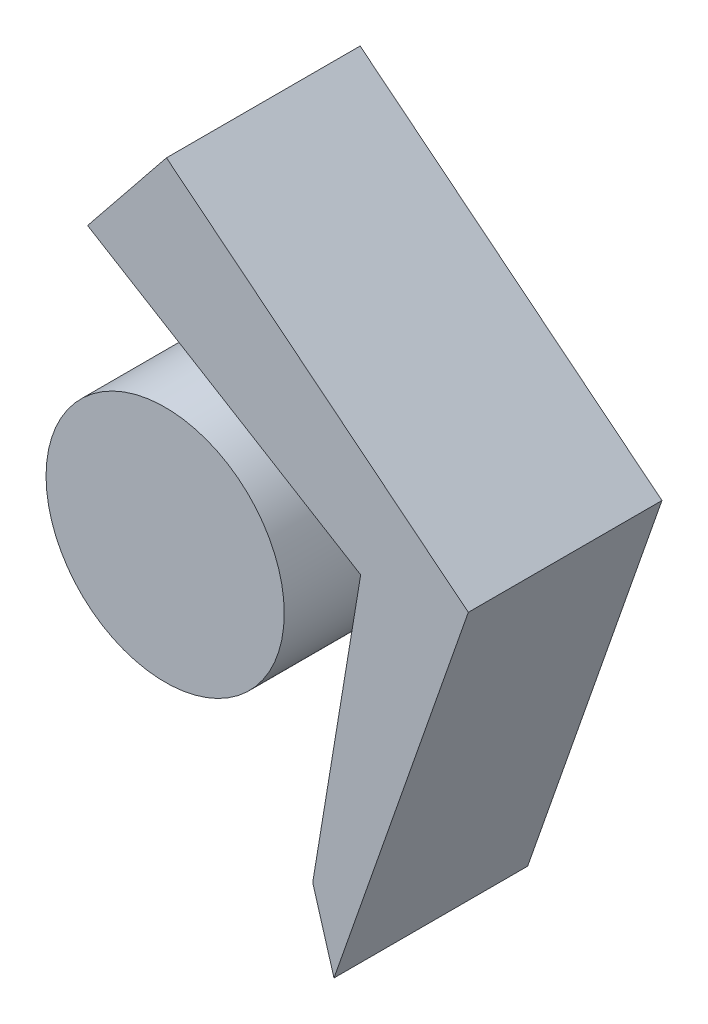
from build123d import *

# Parameters (mm, degrees)
SKETCH_1_R        = 123
EXTRUDE_1_DEPTH   = 200
EXTRUDE_1_2_DEPTH = 200


with BuildPart() as part:
    # 草图1 → 凸台-拉伸1 (new body)
    with BuildSketch(Plane.XY):
        with Locations((-119.476957208, -103.08254604)):
            Circle(SKETCH_1_R)
    extrude(amount=EXTRUDE_1_DEPTH)


with BuildPart() as body_2:
    # 草图1 → Extrude 1 2 (new body)
    with BuildSketch(Plane.XY):
        Polygon((-118.10060406, 243.691104315), (193.620746945, -6.967626489), (54.896105, -403.396023198), (32.933654212, -328.961643632), (82.466282801, -28.961643632), (-199.564691571, 142.381665239), align=None)
    extrude(amount=EXTRUDE_1_2_DEPTH)


solid = Compound([part.part, body_2.part])
